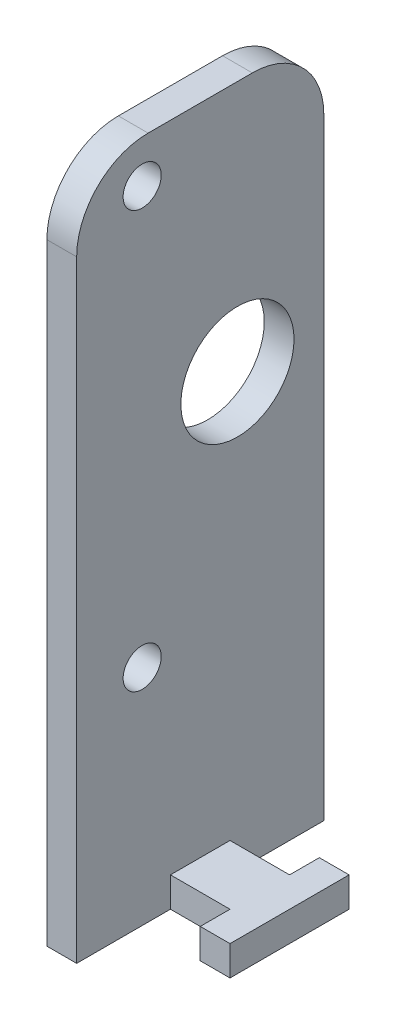
from build123d import *

# Parameters (mm, degrees)
SKETCH1_W               = 80
SKETCH1_H               = 60
BOSS_EXTRUDE1_DEPTH     = 2.5
CUT_EXTRUDE4_DEPTH      = 51.062460986
CUT_EXTRUDE4_DEPTH_BACK = 51.062460986
SKETCH2_R               = 1.6
SKETCH3_W               = 2.5
SKETCH3_H               = 20.5
BOSS_EXTRUDE2_DEPTH     = 66.5
SKETCH4_W               = 80
SKETCH4_H               = 5.5
BOSS_EXTRUDE3_DEPTH     = 2.5
SKETCH5_W               = 2.5
SKETCH5_H               = 5.5
BOSS_EXTRUDE4_DEPTH     = 66.5
SKETCH6_W               = 2.5
SKETCH6_H               = 5.5
CUT_EXTRUDE5_DEPTH      = 66.5
SKETCH9_W               = 2.5
SKETCH9_H               = 2.5
BOSS_EXTRUDE5_DEPTH     = 66.5
SKETCH11_R              = 4.75
CUT_EXTRUDE6_DEPTH      = 2.5
SKETCH15_W              = 2.5
SKETCH15_H              = 23
BOSS_EXTRUDE6_DEPTH     = 8
SKETCH17_W              = 2.5
SKETCH17_H              = 74.5
BOSS_EXTRUDE7_DEPTH     = 2
SKETCH18_R              = 1.6
CUT_EXTRUDE7_DEPTH      = 2.5
SKETCH21_W              = 80
SKETCH21_H              = 2.5
BOSS_EXTRUDE8_DEPTH     = 2
SKETCH22_W              = 4.25
SKETCH22_H              = 74.5
CUT_EXTRUDE8_DEPTH      = 2.5
FILLET1_R               = 5
SKETCH23_W              = 15.225
SKETCH23_H              = 67.5
BOSS_EXTRUDE10_DEPTH    = 2.5
SKETCH24_W              = 95.225
SKETCH24_H              = 10
CUT_EXTRUDE9_DEPTH      = 101.031498164
SKETCH26_W              = 2.5
SKETCH26_H              = 20.75
BOSS_EXTRUDE11_DEPTH    = 74.5
SKETCH27_R              = 1.6
CUT_EXTRUDE10_DEPTH     = 2.5
SKETCH28_W              = 2.5
SKETCH28_H              = 20.75
CUT_EXTRUDE11_DEPTH     = 74.5
SKETCH29_W              = 20.75
SKETCH29_H              = 19.625
CUT_EXTRUDE12_DEPTH     = 2.5
FILLET2_R               = 6
SKETCH31_W              = 13.325
SKETCH31_H              = 57.5
CUT_EXTRUDE13_DEPTH     = 2.5
SKETCH33_W              = 3
SKETCH33_H              = 57.5
CUT_EXTRUDE14_DEPTH     = 2.5
CUT_EXTRUDE15_DEPTH     = 2.5


with BuildPart() as part:
    # Sketch1 → Boss-Extrude1 (new body)
    with BuildSketch(Plane(origin=(0, 0, 0), x_dir=(1, 0, 0), z_dir=(0, 1, 0))):
        Rectangle(SKETCH1_W, SKETCH1_H)
    extrude(amount=BOSS_EXTRUDE1_DEPTH)

    # Sketch2 → Cut-Extrude4 (cut, two sides: drawn at the far end of the back side and taken through both)
    with BuildSketch(Plane(origin=(0, 0, 0), x_dir=(1, 0, 0), z_dir=(0, 1, 0)).offset(-CUT_EXTRUDE4_DEPTH_BACK)):
        with BuildLine():
            Line((-6.25, -24), (-2.5, -24))
            ThreePointArc((-2.5, -24), (0, -21.5), (2.5, -24))
            Line((2.5, -24), (16.25, -24))
            Line((16.25, -24), (16.25, -18))
            Line((16.25, -18), (-6.25, -18))
            Line((-6.25, -18), (-6.25, -24))
        make_face()
        with BuildLine():
            Line((0, -26.5), (0, -30))
            Line((0, -30), (16.25, -30))
            Line((16.25, -30), (16.25, -24))
            Line((16.25, -24), (2.5, -24))
            ThreePointArc((2.5, -24), (1.767766953, -25.767766953), (0, -26.5))
        make_face()
        with BuildLine():
            ThreePointArc((-2.5, -24), (-1.767766953, -25.767766953), (0, -26.5))
            Line((0, -26.5), (0, -24))
            Line((0, -24), (-2.5, -24))
        make_face()
        with BuildLine():
            Line((0, -24), (0, -26.5))
            ThreePointArc((0, -26.5), (1.767766953, -25.767766953), (2.5, -24))
            Line((2.5, -24), (0, -24))
        make_face()
        with BuildLine():
            Line((-2.5, -24), (0, -24))
            Line((0, -24), (2.5, -24))
            ThreePointArc((2.5, -24), (0, -21.5), (-2.5, -24))
        make_face()
        with BuildLine():
            ThreePointArc((-2.5, -24), (-1.767766953, -25.767766953), (0, -26.5))
            Line((0, -26.5), (0, -24))
            Line((0, -24), (-2.5, -24))
        make_face()
        with BuildLine():
            Line((0, -24), (0, -26.5))
            ThreePointArc((0, -26.5), (1.767766953, -25.767766953), (2.5, -24))
            Line((2.5, -24), (0, -24))
        make_face()
        with BuildLine():
            Line((-6.25, -30), (0, -30))
            Line((0, -30), (0, -26.5))
            ThreePointArc((0, -26.5), (-1.767766953, -25.767766953), (-2.5, -24))
            Line((-2.5, -24), (-6.25, -24))
            Line((-6.25, -24), (-6.25, -30))
        make_face()
        with Locations(Location((-8.625, -24, 0), (0, 0, 270))):
            Circle(SKETCH2_R)
        with Locations(Location((18.625, -24, 0), (0, 0, 270))):
            Circle(SKETCH2_R)
    extrude(amount=CUT_EXTRUDE4_DEPTH + CUT_EXTRUDE4_DEPTH_BACK, mode=Mode.SUBTRACT)

    # Sketch3 → Boss-Extrude2 (add)
    with BuildSketch(Plane(origin=(0, 2.5, 0), x_dir=(1, 0, 0), z_dir=(0, 1, 0))):
        with Locations((-38.75, -19.75)):
            Rectangle(SKETCH3_W, SKETCH3_H)
    extrude(amount=BOSS_EXTRUDE2_DEPTH)

    # Sketch4 → Boss-Extrude3 (add)
    with BuildSketch(Plane(origin=(0, 2.5, 0), x_dir=(1, 0, 0), z_dir=(0, 1, 0))):
        with Locations((0, -32.75)):
            Rectangle(SKETCH4_W, SKETCH4_H)
    extrude(amount=-BOSS_EXTRUDE3_DEPTH)

    # Sketch5 → Boss-Extrude4 (add)
    with BuildSketch(Plane(origin=(0, 2.5, 0), x_dir=(1, 0, 0), z_dir=(0, 1, 0))):
        with Locations((-38.75, -32.75)):
            Rectangle(SKETCH5_W, SKETCH5_H)
    extrude(amount=BOSS_EXTRUDE4_DEPTH)

    # Sketch6 → Cut-Extrude5 (cut)
    with BuildSketch(Plane(origin=(0, 69, 0), x_dir=(1, 0, 0), z_dir=(0, 1, 0))):
        with Locations((-38.75, -12.25)):
            Rectangle(SKETCH6_W, SKETCH6_H)
    extrude(amount=-CUT_EXTRUDE5_DEPTH, mode=Mode.SUBTRACT)

    # Sketch9 → Boss-Extrude5 (add)
    with BuildSketch(Plane(origin=(0, 2.5, 0), x_dir=(1, 0, 0), z_dir=(0, 1, 0))):
        with Locations((-38.75, -13.75)):
            Rectangle(SKETCH9_W, SKETCH9_H)
    extrude(amount=BOSS_EXTRUDE5_DEPTH)

    # Sketch11 → Cut-Extrude6 (cut)
    with BuildSketch(Plane(origin=(-37.5, 0, 0), x_dir=(0, 0, -1), z_dir=(1, 0, 0))):
        with Locations((-24, 54)):
            Circle(SKETCH11_R)
    extrude(amount=-CUT_EXTRUDE6_DEPTH, mode=Mode.SUBTRACT)

    # Sketch15 → Boss-Extrude6 (add)
    with BuildSketch(Plane(origin=(0, 69, 0), x_dir=(1, 0, 0), z_dir=(0, 1, 0))):
        with Locations((-38.75, -24)):
            Rectangle(SKETCH15_W, SKETCH15_H)
    extrude(amount=BOSS_EXTRUDE6_DEPTH)

    # Sketch17 → Boss-Extrude7 (add)
    with BuildSketch(Plane.XY.offset(35.5)):
        with Locations((-38.75, 39.75)):
            Rectangle(SKETCH17_W, SKETCH17_H)
    extrude(amount=BOSS_EXTRUDE7_DEPTH)

    # Sketch18 → Cut-Extrude7 (cut)
    with BuildSketch(Plane.ZY.offset(40)):
        with Locations((32, 36.5)):
            Circle(SKETCH18_R)
        with Locations((32, 71.5)):
            Circle(SKETCH18_R)
    extrude(amount=-CUT_EXTRUDE7_DEPTH, mode=Mode.SUBTRACT)

    # Sketch21 → Boss-Extrude8 (add)
    with BuildSketch(Plane.XY.offset(35.5)):
        with Locations((0, 1.25)):
            Rectangle(SKETCH21_W, SKETCH21_H)
    extrude(amount=BOSS_EXTRUDE8_DEPTH)

    # Sketch22 → Cut-Extrude8 (cut)
    with BuildSketch(Plane(origin=(-37.5, 0, 0), x_dir=(0, 0, -1), z_dir=(1, 0, 0))):
        with Locations((-14.625, 39.75)):
            Rectangle(SKETCH22_W, SKETCH22_H)
    extrude(amount=-CUT_EXTRUDE8_DEPTH, mode=Mode.SUBTRACT)

    # Fillet1
    fillet1_edges = [part.edges().sort_by_distance(p)[0] for p in [
        (-38.75, 77, 37.5),
        (-38.75, 77, 16.75),
    ]]
    fillet(fillet1_edges, radius=FILLET1_R)

    # Sketch23 → Boss-Extrude10 (add)
    with BuildSketch(Plane(origin=(0, 2.5, 0), x_dir=(1, 0, 0), z_dir=(0, 1, 0))):
        with Locations((47.6125, -3.75)):
            Rectangle(SKETCH23_W, SKETCH23_H)
    extrude(amount=-BOSS_EXTRUDE10_DEPTH)

    # Sketch24 → Cut-Extrude9 (cut, through all)
    with BuildSketch(Plane(origin=(0, 2.5, 0), x_dir=(1, 0, 0), z_dir=(0, 1, 0))):
        with Locations((7.6125, 25)):
            Rectangle(SKETCH24_W, SKETCH24_H)
    extrude(amount=-CUT_EXTRUDE9_DEPTH, mode=Mode.SUBTRACT)

    # Sketch26 → Boss-Extrude11 (add)
    with BuildSketch(Plane(origin=(0, 2.5, 0), x_dir=(1, 0, 0), z_dir=(0, 1, 0))):
        with Locations((-25.425, -27.125)):
            Rectangle(SKETCH26_W, SKETCH26_H)
    extrude(amount=BOSS_EXTRUDE11_DEPTH)

    # Sketch27 → Cut-Extrude10 (cut)
    with BuildSketch(Plane(origin=(-24.175, 0, 0), x_dir=(0, 0, -1), z_dir=(1, 0, 0))):
        with BuildLine():
            ThreePointArc((-28.75, 36.275), (-27.358757211, 32.916242789), (-24, 31.525))
            Line((-24, 31.525), (-24, 36.275))
            Line((-24, 36.275), (-28.75, 36.275))
        make_face()
        with BuildLine():
            Line((-24, 36.275), (-24, 31.525))
            ThreePointArc((-24, 31.525), (-20.641242789, 32.916242789), (-19.25, 36.275))
            ThreePointArc((-19.25, 36.275), (-24, 41.025), (-28.75, 36.275))
            Line((-28.75, 36.275), (-24, 36.275))
        make_face()
        with BuildLine():
            ThreePointArc((-28.75, 36.275), (-27.358757211, 32.916242789), (-24, 31.525))
            Line((-24, 31.525), (-24, 36.275))
            Line((-24, 36.275), (-28.75, 36.275))
        make_face()
        with BuildLine():
            Line((-24, 36.275), (-24, 31.525))
            ThreePointArc((-24, 31.525), (-20.641242789, 32.916242789), (-19.25, 36.275))
            ThreePointArc((-19.25, 36.275), (-24, 41.025), (-28.75, 36.275))
            Line((-28.75, 36.275), (-24, 36.275))
        make_face()
        with Locations((-32, 18.775)):
            Circle(SKETCH27_R)
        with Locations((-32, 53.775)):
            Circle(SKETCH27_R)
    extrude(amount=-CUT_EXTRUDE10_DEPTH, mode=Mode.SUBTRACT)

    # Sketch28 → Cut-Extrude11 (cut)
    with BuildSketch(Plane(origin=(0, 77, 0), x_dir=(1, 0, 0), z_dir=(0, 1, 0))):
        with Locations((-38.75, -27.125)):
            Rectangle(SKETCH28_W, SKETCH28_H)
    extrude(amount=-CUT_EXTRUDE11_DEPTH, mode=Mode.SUBTRACT)

    # Sketch29 → Cut-Extrude12 (cut)
    with BuildSketch(Plane(origin=(-24.175, 0, 0), x_dir=(0, 0, -1), z_dir=(1, 0, 0))):
        with Locations((-27.125, 67.1875)):
            Rectangle(SKETCH29_W, SKETCH29_H)
    extrude(amount=-CUT_EXTRUDE12_DEPTH, mode=Mode.SUBTRACT)

    # Fillet2
    fillet2_edges = [part.edges().sort_by_distance(p)[0] for p in [
        (-25.425, 57.375, 37.5),
        (-25.425, 57.375, 16.75),
    ]]
    fillet(fillet2_edges, radius=FILLET2_R)

    # Sketch31 → Cut-Extrude13 (cut)
    with BuildSketch(Plane(origin=(0, 2.5, 0), x_dir=(1, 0, 0), z_dir=(0, 1, 0))):
        with Locations((-33.3375, -8.75)):
            Rectangle(SKETCH31_W, SKETCH31_H)
    extrude(amount=-CUT_EXTRUDE13_DEPTH, mode=Mode.SUBTRACT)

    # Sketch33 → Cut-Extrude14 (cut)
    with BuildSketch(Plane(origin=(0, 2.5, 0), x_dir=(1, 0, 0), z_dir=(0, 1, 0))):
        with Locations((53.725, -8.75)):
            Rectangle(SKETCH33_W, SKETCH33_H)
    extrude(amount=-CUT_EXTRUDE14_DEPTH, mode=Mode.SUBTRACT)

    # Sketch34 → Cut-Extrude15 (cut)
    with BuildSketch(Plane(origin=(0, 2.5, 0), x_dir=(1, 0, 0), z_dir=(0, 1, 0))):
        Polygon((-24.175, -16.75), (-24.175, -24.625), (-19.175, -24.625), (-19.175, -22.125), (-16.675, -22.125), (-16.675, -32.125), (-19.175, -32.125), (-19.175, -29.625), (-24.175, -29.625), (-24.175, -37.5), (52.225, -37.5), (52.225, 20), (-26.675, 20), (-26.675, -16.75), align=None)
    extrude(amount=-CUT_EXTRUDE15_DEPTH, mode=Mode.SUBTRACT)


solid = part.part
